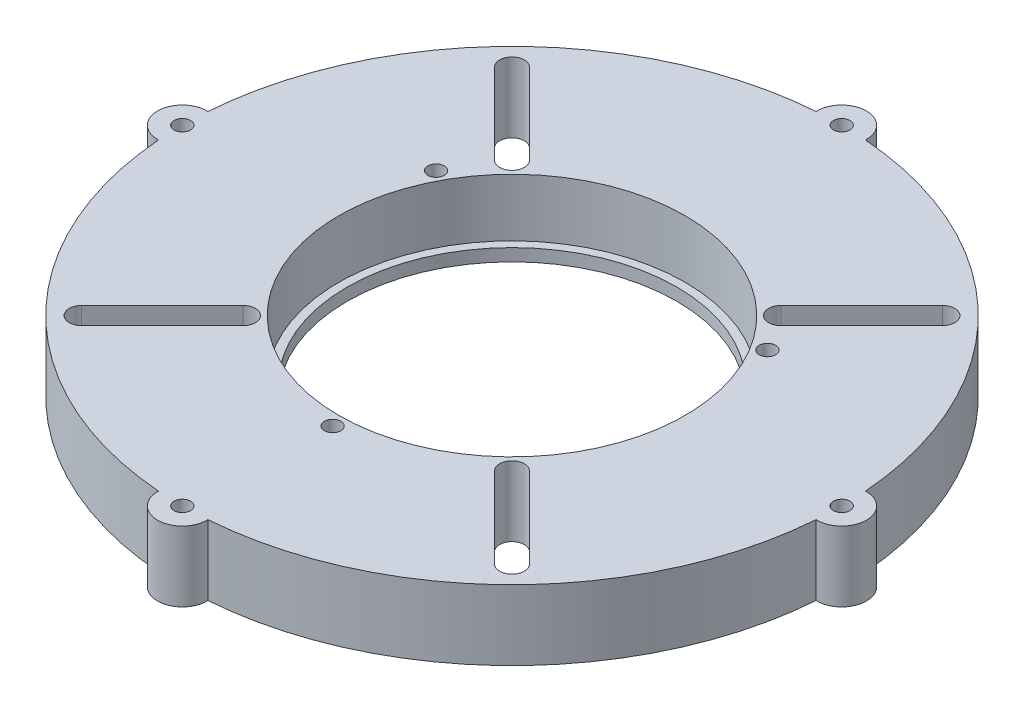
from build123d import *

# Parameters (mm, degrees)
SKETCH1_R                               = 40
SKETCH1_R_2                             = 20
BOSS_EXTRUDE1_DEPTH                     = 8.5
SKETCH2_R                               = 1
CUT_EXTRUDE2_DEPTH                      = 58.203583804
SKETCH2_6_R                             = 3
SKETCH2_6_R_2                           = 1
BOSS_EXTRUDE3_DEPTH                     = 8.5
CIRPATTERN1_COUNT                       = 4
CUT_EXTRUDE4_DEPTH                      = 62.402361518
CIRPATTERN3_COUNT                       = 4
SKETCH7_R                               = 21
CUT_EXTRUDE5_DEPTH                      = 7
SKETCH8_R                               = 1
OUTER_RETAINER_M2_TAPPED_ENVELOPE_DEPTH = 4.3


with BuildPart() as part:
    # Sketch1 → Boss-Extrude1 (new body)
    with BuildSketch(Plane(origin=(0, 0, 0), x_dir=(1, 0, 0), z_dir=(0, 1, 0))):
        Circle(SKETCH1_R)
        Circle(SKETCH1_R_2, mode=Mode.SUBTRACT)
    extrude(amount=BOSS_EXTRUDE1_DEPTH)

    # Sketch2 → Cut-Extrude2 (cut, through all)
    with BuildSketch(Plane(origin=(0, 8.5, 0), x_dir=(1, 0, 0), z_dir=(0, 1, 0))):
        with Locations((40, 0)):
            Circle(SKETCH2_R)
    cut_extrude2 = extrude(amount=-CUT_EXTRUDE2_DEPTH, mode=Mode.SUBTRACT)

    # Sketch2<6> → Boss-Extrude3 (add)
    with BuildSketch(Plane(origin=(0, 8.5, 0), x_dir=(1, 0, 0), z_dir=(0, 1, 0))):
        with Locations((40, 0)):
            Circle(SKETCH2_6_R)
        with Locations((40, 0)):
            Circle(SKETCH2_6_R_2, mode=Mode.SUBTRACT)
    boss_extrude3 = extrude(amount=-BOSS_EXTRUDE3_DEPTH)

    # CirPattern1: Cut-Extrude2, Boss-Extrude3 ×4 about axis
    cirpattern1_axis = Axis((0, 8.5, 0), (0, 1, 0))
    add([cut_extrude2.rotate(cirpattern1_axis, i * 360 / CIRPATTERN1_COUNT) for i in range(1, CIRPATTERN1_COUNT)], mode=Mode.SUBTRACT)
    add([boss_extrude3.rotate(cirpattern1_axis, i * 360 / CIRPATTERN1_COUNT) for i in range(1, CIRPATTERN1_COUNT)])

    # Sketch4 → Cut-Extrude4 (cut, through all)
    with BuildSketch(Plane(origin=(0, 8.5, 0), x_dir=(1, 0, 0), z_dir=(0, 1, 0))):
        with BuildLine():
            Line((-27.170578067, -25.049257724), (-17.377149148, -15.255828804))
            ThreePointArc((-17.377149148, -15.255828804), (-15.255828804, -15.255828804), (-15.255828804, -17.377149148))
            Line((-15.255828804, -17.377149148), (-25.049257724, -27.170578067))
            ThreePointArc((-25.049257724, -27.170578067), (-27.170578067, -27.170578067), (-27.170578067, -25.049257724))
        make_face()
    cut_extrude4 = extrude(amount=-CUT_EXTRUDE4_DEPTH, mode=Mode.SUBTRACT)

    # CirPattern3: Cut-Extrude4 ×4 about axis
    cirpattern3_axis = Axis((0, 8.5, 0), (0, 1, 0))
    for i in range(1, CIRPATTERN3_COUNT):
        add(cut_extrude4.rotate(cirpattern3_axis, i * 360 / CIRPATTERN3_COUNT), mode=Mode.SUBTRACT)

    # Sketch7 → Cut-Extrude5 (cut)
    with BuildSketch(Plane(origin=(0, 8.5, 0), x_dir=(1, 0, 0), z_dir=(0, 1, 0))):
        Circle(SKETCH7_R)
    extrude(amount=-CUT_EXTRUDE5_DEPTH, mode=Mode.SUBTRACT)

    # Sketch8 → Outer_Retainer_M2_Tapped_Envelope (cut)
    with BuildSketch(Plane(origin=(0, 8.5, 0), x_dir=(1, 0, 0), z_dir=(0, 1, 0))):
        with Locations((0.720053396, -22.48847534)):
            Circle(SKETCH8_R)
        with Locations((19.115564239, 11.867822203)):
            Circle(SKETCH8_R)
        with Locations((-19.835617634, 10.620653137)):
            Circle(SKETCH8_R)
    extrude(amount=-OUTER_RETAINER_M2_TAPPED_ENVELOPE_DEPTH, mode=Mode.SUBTRACT)


solid = part.part
